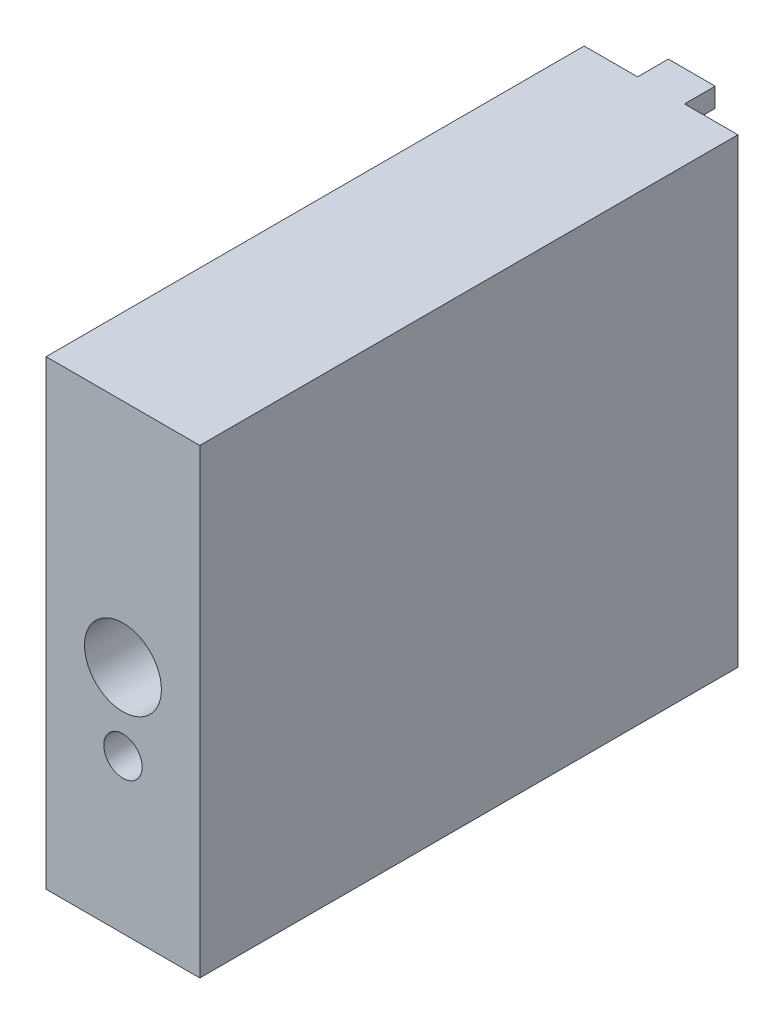
from build123d import *

# Parameters (mm, degrees)
EXTRUDE_1_DEPTH      = 14
CUT_EXTRUDE_1_DEPTH  = 44
SKETCH_3_W           = 6.2
SKETCH_3_H           = 6.2
CUT_EXTRUDE_2_DEPTH  = 4
SKETCH_4_R           = 4
CUT_EXTRUDE_3_DEPTH  = 5
SKETCH_5_R           = 2.6
CUT_EXTRUDE_4_DEPTH  = 5
CUT_EXTRUDE_5_DEPTH  = 50
EXTRUDE_2_DEPTH      = 8
EXTRUDE_3_DEPTH      = 8
SKETCH_10_W          = 20
SKETCH_10_H          = 10
EXTRUDE_4_DEPTH      = 18
SKETCH_12_R          = 1.48
CUT_EXTRUDE_6_DEPTH  = 20
SKETCH_13_W          = 4
SKETCH_13_H          = 40
CUT_EXTRUDE_7_DEPTH  = 22
SKETCH_16_R          = 5
CUT_EXTRUDE_8_DEPTH  = 3
SKETCH_17_R          = 5
CUT_EXTRUDE_9_DEPTH  = 3
SKETCH_18_R          = 2.6
CUT_EXTRUDE_10_DEPTH = 99
SKETCH_19_R          = 5
EXTRUDE_5_DEPTH      = 6
SKETCH_20_W          = 6.2
SKETCH_20_H          = 6.2
CUT_EXTRUDE_11_DEPTH = 4
SKETCH_21_W          = 6.2
SKETCH_21_H          = 6.2
EXTRUDE_6_DEPTH      = 4
SKETCH_22_W          = 0.05
SKETCH_22_H          = 60
CUT_EXTRUDE_12_DEPTH = 4
EXTRUDE_START        = 6
SKETCH_25_W          = 20
SKETCH_25_H          = 10
SKETCH_25_R          = 1.48
EXTRUDE_7_DEPTH      = 6
CUT_EXTRUDE_13_DEPTH = 7
SKETCH_28_W          = 8
SKETCH_28_H          = 10
EXTRUDE_8_DEPTH      = 20
CUT_EXTRUDE_14_DEPTH = 7
SKETCH_30_W          = 6
SKETCH_30_H          = 2.9827115
SKETCH_30_H_2        = 3.265133333
EXTRUDE_9_DEPTH      = 7
SKETCH_31_W          = 6
SKETCH_31_H          = 2
EXTRUDE_10_DEPTH     = 10
SKETCH_32_W          = 6.1
SKETCH_32_H          = 3
CUT_EXTRUDE_15_DEPTH = 10
SKETCH_33_W          = 6.1
SKETCH_33_H          = 3
CUT_EXTRUDE_16_DEPTH = 4
SKETCH_34_W          = 10
SKETCH_34_H          = 5
CUT_EXTRUDE_17_DEPTH = 6
SKETCH_35_W          = 1
SKETCH_35_H          = 5
CUT_EXTRUDE_18_DEPTH = 14
SKETCH_36_W          = 6
SKETCH_36_H          = 5
EXTRUDE_11_DEPTH     = 6
SKETCH_37_W          = 8
SKETCH_37_H          = 1
CUT_EXTRUDE_19_DEPTH = 2
SKETCH_38_R          = 5
EXTRUDE_12_DEPTH     = 6
SKETCH_39_R          = 2.6
CUT_EXTRUDE_20_DEPTH = 10
SKETCH_40_R          = 5
CUT_EXTRUDE_21_DEPTH = 3
EXTRUDE_START_2      = 1
SKETCH_41_W          = 20
SKETCH_41_H          = 40
SKETCH_41_R          = 5
EXTRUDE_13_DEPTH     = 1
SKETCH_42_W          = 20
SKETCH_42_H          = 10
SKETCH_42_R          = 1.48
EXTRUDE_14_DEPTH     = 1
SKETCH_43_W          = 5
SKETCH_43_H          = 5
CUT_EXTRUDE_22_DEPTH = 15
EXTRUDE_15_DEPTH     = 2
SKETCH_45_W          = 6.1
SKETCH_45_H          = 18.1
EXTRUDE_16_DEPTH     = 10
CUT_EXTRUDE_START    = -4
CUT_EXTRUDE_23_DEPTH = 4
SKETCH_47_W          = 15
SKETCH_47_H          = 7.002427308
EXTRUDE_17_DEPTH     = 4
CUT_EXTRUDE_24_DEPTH = 1
SKETCH_49_W          = 2
SKETCH_49_H          = 1
CUT_EXTRUDE_27_DEPTH = 12.5
SKETCH_51_W          = 5
SKETCH_51_H          = 1
EXTRUDE_18_DEPTH     = 1
CUT_EXTRUDE_28_DEPTH = 5
EXTRUDE_19_DEPTH     = 7.5
SKETCH_54_W          = 6.95
SKETCH_54_H          = 2
CUT_EXTRUDE_29_DEPTH = 7.5
SKETCH_55_W          = 6.1
SKETCH_55_H          = 3
CUT_EXTRUDE_30_DEPTH = 4
SKETCH_56_W          = 0.55
SKETCH_56_H          = 0.142857143
EXTRUDE_20_DEPTH     = 4
SKETCH_60_W          = 26.3
SKETCH_60_H          = 60
EXTRUDE_21_DEPTH     = 20
EXTRUDE_22_DEPTH     = 4
SKETCH_62_R          = 2.6
CUT_EXTRUDE_31_DEPTH = 50
SKETCH_63_R          = 5
CUT_EXTRUDE_32_DEPTH = 30.3
CUT_EXTRUDE_33_DEPTH = 4
CUT_EXTRUDE_34_DEPTH = 2
SKETCH_66_W          = 5
SKETCH_66_H          = 2
CUT_EXTRUDE_35_DEPTH = 50
CUT_EXTRUDE_36_DEPTH = 4
SKETCH_68_W          = 5
SKETCH_68_H          = 2
CUT_EXTRUDE_37_DEPTH = 2
SKETCH_69_W          = 13
SKETCH_69_H          = 7
EXTRUDE_23_DEPTH     = 15
SKETCH_70_W          = 13
SKETCH_70_H          = 7
CUT_EXTRUDE_38_DEPTH = 15
SKETCH_72_W          = 20
SKETCH_72_H          = 60
EXTRUDE_24_DEPTH     = 61.3
SKETCH_73_W          = 6.1
SKETCH_73_H          = 12
EXTRUDE_25_DEPTH     = 4
SKETCH_74_R          = 2.6
CUT_EXTRUDE_39_DEPTH = 70
SKETCH_76_W          = 70
SKETCH_76_H          = 60
EXTRUDE_26_DEPTH     = 20
SKETCH_77_R          = 2.6
CUT_EXTRUDE_40_DEPTH = 70
SKETCH_78_R          = 5
CUT_EXTRUDE_41_DEPTH = 67
SKETCH_79_R          = 2.5
CUT_EXTRUDE_42_DEPTH = 30
SKETCH_80_R          = 1.48
CUT_EXTRUDE_43_DEPTH = 10
SKETCH_81_W          = 4.45
SKETCH_81_H          = 15
SKETCH_81_W_2        = 6.1
CUT_EXTRUDE_45_DEPTH = 65
SKETCH_82_W          = 4.45
SKETCH_82_H          = 12.5
SKETCH_82_W_2        = 3.05
CUT_EXTRUDE_46_DEPTH = 65


with BuildPart() as part:
    # 草图1 → 凸台-拉伸1 (new body)
    with BuildSketch(Plane.XY):
        Polygon((-15, 22), (-15, -22), (15, -22), (15, 22), (0, 22), align=None)
    extrude(amount=EXTRUDE_1_DEPTH)

    # 草图2 → 切除-拉伸1 (cut)
    with BuildSketch(Plane(origin=(0, 22, 0), x_dir=(1, 0, 0), z_dir=(0, 1, 0))):
        Polygon((-15, 0), (-15, -14), (-10, -4), (-3.1, -4), (-3.1, 0), align=None)
        Polygon((3.1, -4), (10, -4), (15, -14), (15, 0), (3.1, 0), align=None)
    extrude(amount=-CUT_EXTRUDE_1_DEPTH, mode=Mode.SUBTRACT)

    # 草图3 → 切除-拉伸2 (cut)
    with BuildSketch(Plane(origin=(0, 0, 0), x_dir=(-1, 0, 0), z_dir=(0, 0, -1))):
        Rectangle(SKETCH_3_W, SKETCH_3_H)
    extrude(amount=-CUT_EXTRUDE_2_DEPTH, mode=Mode.SUBTRACT)

    # 草图4 → 切除-拉伸3 (cut)
    with BuildSketch(Plane.XY.offset(14)):
        Circle(SKETCH_4_R)
    extrude(amount=-CUT_EXTRUDE_3_DEPTH, mode=Mode.SUBTRACT)

    # 草图5 → 切除-拉伸4 (cut)
    with BuildSketch(Plane.XY.offset(9)):
        Circle(SKETCH_5_R)
    extrude(amount=-CUT_EXTRUDE_4_DEPTH, mode=Mode.SUBTRACT)

    # 草图6 → 切除-拉伸5 (cut)
    with BuildSketch(Plane.XZ.offset(22)):
        Polygon((-10, 4), (-15, 14), (-10, 14), align=None)
        Polygon((10, 4), (10, 14), (15, 14), align=None)
    extrude(amount=-CUT_EXTRUDE_5_DEPTH, mode=Mode.SUBTRACT)

    # 草图8 → 凸台-拉伸2 (add)
    with BuildSketch(Plane(origin=(0, -22, 0), x_dir=(-1, 0, 0), z_dir=(0, -1, 0))):
        Polygon((10, -14), (-10, -14), (-10, -4), (-3.1, -4), (-3.1, 0), (3.1, 0), (3.1, -4), (10, -4), align=None)
    extrude(amount=EXTRUDE_2_DEPTH)

    # 草图9 → 凸台-拉伸3 (add)
    with BuildSketch(Plane(origin=(0, 22, 0), x_dir=(1, 0, 0), z_dir=(0, 1, 0))):
        Polygon((-3.1, -4), (-3.1, 0), (3.1, 0), (3.1, -4), (10, -4), (10, -14), (-10, -14), (-10, -4), align=None)
    extrude(amount=EXTRUDE_3_DEPTH)

    # 草图10 → 凸台-拉伸4 (add)
    with BuildSketch(Plane.XY.offset(14)):
        with Locations((0, 25)):
            Rectangle(SKETCH_10_W, SKETCH_10_H)
        with Locations((0, -25)):
            Rectangle(SKETCH_10_W, SKETCH_10_H)
    extrude(amount=EXTRUDE_4_DEPTH)

    # 草图12 → 切除-拉伸6 (cut)
    with BuildSketch(Plane.XY.offset(32)):
        with Locations((-4.9, -24.6)):
            Circle(SKETCH_12_R)
        with Locations((4.9, -24.6)):
            Circle(SKETCH_12_R)
        with Locations((-4.9, 24.6)):
            Circle(SKETCH_12_R)
        with Locations((4.9, 24.6)):
            Circle(SKETCH_12_R)
    extrude(amount=-CUT_EXTRUDE_6_DEPTH, mode=Mode.SUBTRACT)

    # 草图13 → 切除-拉伸7 (cut)
    with BuildSketch(Plane(origin=(10, 0, 0), x_dir=(0, 0, -1), z_dir=(1, 0, 0))):
        with Locations((-12, 0)):
            Rectangle(SKETCH_13_W, SKETCH_13_H)
    extrude(amount=-CUT_EXTRUDE_7_DEPTH, mode=Mode.SUBTRACT)

    # 草图16 → 切除-拉伸8 (cut)
    with BuildSketch(Plane.XY.offset(10)):
        Circle(SKETCH_16_R)
    extrude(amount=-CUT_EXTRUDE_8_DEPTH, mode=Mode.SUBTRACT)

    # 草图17 → 切除-拉伸9 (cut)
    with BuildSketch(Plane.XY.offset(10)):
        with Locations((0, 15)):
            Circle(SKETCH_17_R)
        with Locations((0, -15)):
            Circle(SKETCH_17_R)
    extrude(amount=-CUT_EXTRUDE_9_DEPTH, mode=Mode.SUBTRACT)

    # 草图18 → 切除-拉伸10 (cut)
    with BuildSketch(Plane.XY.offset(7)):
        with Locations((0, 15)):
            Circle(SKETCH_18_R)
        with Locations((0, -15)):
            Circle(SKETCH_18_R)
    extrude(amount=-CUT_EXTRUDE_10_DEPTH, mode=Mode.SUBTRACT)

    # 草图19 → 凸台-拉伸5 (add)
    with BuildSketch(Plane.XY.offset(10)):
        Circle(SKETCH_19_R)
    extrude(amount=-EXTRUDE_5_DEPTH)

    # 草图20 → 切除-拉伸11 (cut)
    with BuildSketch(Plane(origin=(0, 0, 0), x_dir=(-1, 0, 0), z_dir=(0, 0, -1))):
        Polygon((0, -11.9), (0, -15), (0, -18.1), (3.1, -18.1), (3.1, -11.9), align=None)
        Polygon((0, -18.1), (0, -15), (0, -11.9), (-3.1, -11.9), (-3.1, -18.1), align=None)
        with Locations((0, 15)):
            Rectangle(SKETCH_20_W, SKETCH_20_H)
    extrude(amount=-CUT_EXTRUDE_11_DEPTH, mode=Mode.SUBTRACT)

    # 草图21 → 凸台-拉伸6 (add)
    with BuildSketch(Plane(origin=(0, 0, 0), x_dir=(-1, 0, 0), z_dir=(0, 0, -1))):
        Rectangle(SKETCH_21_W, SKETCH_21_H)
    extrude(amount=-EXTRUDE_6_DEPTH)

    # 草图22 → 切除-拉伸12 (cut)
    with BuildSketch(Plane(origin=(0, 0, 0), x_dir=(-1, 0, 0), z_dir=(0, 0, -1))):
        with Locations((-3.075, 0)):
            Rectangle(SKETCH_22_W, SKETCH_22_H)
        with Locations((3.075, 0)):
            Rectangle(SKETCH_22_W, SKETCH_22_H)
    extrude(amount=-CUT_EXTRUDE_12_DEPTH, mode=Mode.SUBTRACT)

    # 草图25 → 凸台-拉伸7 (add)
    # profile 1 of 2: a face of its own
    with BuildSketch(Plane.XY.offset(32).offset(EXTRUDE_START)):
        with Locations((0, 25)):
            Rectangle(SKETCH_25_W, SKETCH_25_H)
        with Locations((-4.9, 24.6)):
            Circle(SKETCH_25_R, mode=Mode.SUBTRACT)
        with Locations((4.9, 24.6)):
            Circle(SKETCH_25_R, mode=Mode.SUBTRACT)
    # profile 2 of 2: a face of its own
    with BuildSketch(Plane.XY.offset(32).offset(EXTRUDE_START)):
        with Locations((0, -25)):
            Rectangle(SKETCH_25_W, SKETCH_25_H)
        with Locations((-4.9, -24.6)):
            Circle(SKETCH_25_R, mode=Mode.SUBTRACT)
        with Locations((4.9, -24.6)):
            Circle(SKETCH_25_R, mode=Mode.SUBTRACT)
    extrude(amount=-EXTRUDE_7_DEPTH)

    # 草图27 → 切除-拉伸13 (cut)
    with BuildSketch(Plane(origin=(0, -20, 0), x_dir=(1, 0, 0), z_dir=(0, 1, 0))):
        Polygon((4, -15), (4, -10), (0, -10), (-4, -10), (-4, -15), align=None)
    extrude(amount=-CUT_EXTRUDE_13_DEPTH, mode=Mode.SUBTRACT)

    # 草图28 → 凸台-拉伸8 (add)
    with BuildSketch(Plane.ZY.offset(10)):
        with Locations((14, -25)):
            Rectangle(SKETCH_28_W, SKETCH_28_H)
        with Locations((14, 25)):
            Rectangle(SKETCH_28_W, SKETCH_28_H)
    extrude(amount=-EXTRUDE_8_DEPTH)

    # 草图29 → 切除-拉伸14 (cut)
    with BuildSketch(Plane(origin=(0, -20, 0), x_dir=(1, 0, 0), z_dir=(0, 1, 0))):
        Polygon((4, -20), (4, -10), (0, -10), (-4, -10), (-4, -20), align=None)
    extrude(amount=-CUT_EXTRUDE_14_DEPTH, mode=Mode.SUBTRACT)

    # 草图30 → 凸台-拉伸9 (add)
    with BuildSketch(Plane(origin=(0, -20, 0), x_dir=(1, 0, 0), z_dir=(0, 1, 0))):
        with Locations((-7, -18.50864425)):
            Rectangle(SKETCH_30_W, SKETCH_30_H)
        with Locations((7, -18.367433334)):
            Rectangle(SKETCH_30_W, SKETCH_30_H_2)
    extrude(amount=-EXTRUDE_9_DEPTH)

    # 草图31 → 凸台-拉伸10 (add)
    with BuildSketch(Plane(origin=(0, -20, 0), x_dir=(1, 0, 0), z_dir=(0, 1, 0))):
        with Locations((7, -21)):
            Rectangle(SKETCH_31_W, SKETCH_31_H)
        Polygon((4, -22), (4, -20), (-4, -20), (-10, -20), (-10, -22), align=None)
    extrude(amount=-EXTRUDE_10_DEPTH)

    # 草图32 → 切除-拉伸15 (cut)
    with BuildSketch(Plane(origin=(0, 0, 0), x_dir=(-1, 0, 0), z_dir=(0, 0, -1))):
        with Locations((0, -25.5)):
            Rectangle(SKETCH_32_W, SKETCH_32_H)
    extrude(amount=-CUT_EXTRUDE_15_DEPTH, mode=Mode.SUBTRACT)

    # 草图33 → 切除-拉伸16 (cut)
    with BuildSketch(Plane(origin=(0, 0, 0), x_dir=(-1, 0, 0), z_dir=(0, 0, -1))):
        with Locations((0, -28.5)):
            Rectangle(SKETCH_33_W, SKETCH_33_H)
    extrude(amount=-CUT_EXTRUDE_16_DEPTH, mode=Mode.SUBTRACT)

    # 草图34 → 切除-拉伸17 (cut)
    with BuildSketch(Plane.ZY.offset(10)):
        with Locations((15, -22.5)):
            Rectangle(SKETCH_34_W, SKETCH_34_H)
    extrude(amount=-CUT_EXTRUDE_17_DEPTH, mode=Mode.SUBTRACT)

    # 草图35 → 切除-拉伸18 (cut)
    with BuildSketch(Plane.ZY.offset(10)):
        with Locations((20.5, -22.5)):
            Rectangle(SKETCH_35_W, SKETCH_35_H)
    extrude(amount=-CUT_EXTRUDE_18_DEPTH, mode=Mode.SUBTRACT)

    # 草图36 → 凸台-拉伸11 (add)
    with BuildSketch(Plane.ZY.offset(10)):
        with Locations((13, -22.5)):
            Rectangle(SKETCH_36_W, SKETCH_36_H)
    extrude(amount=-EXTRUDE_11_DEPTH)

    # 草图37 → 切除-拉伸19 (cut)
    with BuildSketch(Plane(origin=(0, -25, 0), x_dir=(1, 0, 0), z_dir=(0, 1, 0))):
        with Locations((0, -20.5)):
            Rectangle(SKETCH_37_W, SKETCH_37_H)
    extrude(amount=-CUT_EXTRUDE_19_DEPTH, mode=Mode.SUBTRACT)

    # 草图38 → 凸台-拉伸12 (add)
    with BuildSketch(Plane.XY.offset(10)):
        with Locations((0, 15)):
            Circle(SKETCH_38_R)
        with Locations((0, -15)):
            Circle(SKETCH_38_R)
    extrude(amount=-EXTRUDE_12_DEPTH)

    # 草图39 → 切除-拉伸20 (cut)
    with BuildSketch(Plane.XY.offset(10)):
        Circle(SKETCH_39_R)
    extrude(amount=-CUT_EXTRUDE_20_DEPTH, mode=Mode.SUBTRACT)

    # 草图40 → 切除-拉伸21 (cut)
    with BuildSketch(Plane.XY.offset(10)):
        Circle(SKETCH_40_R)
    extrude(amount=-CUT_EXTRUDE_21_DEPTH, mode=Mode.SUBTRACT)

    # 草图41 → 凸台-拉伸13 (add)
    with BuildSketch(Plane.XY.offset(10).offset(EXTRUDE_START_2)):
        Rectangle(SKETCH_41_W, SKETCH_41_H)
        Circle(SKETCH_41_R, mode=Mode.SUBTRACT)
    extrude(amount=-EXTRUDE_13_DEPTH)

    # 草图42 → 凸台-拉伸14 (add)
    # profile 1 of 2: a face of its own
    with BuildSketch(Plane.XY.offset(38).offset(EXTRUDE_START_2)):
        with Locations((0, 25)):
            Rectangle(SKETCH_42_W, SKETCH_42_H)
        with Locations((-4.9, 24.6)):
            Circle(SKETCH_42_R, mode=Mode.SUBTRACT)
        with Locations((4.9, 24.6)):
            Circle(SKETCH_42_R, mode=Mode.SUBTRACT)
    # profile 2 of 2: a face of its own
    with BuildSketch(Plane.XY.offset(38).offset(EXTRUDE_START_2)):
        with Locations((0, -25)):
            Rectangle(SKETCH_42_W, SKETCH_42_H)
        with Locations((-4.9, -24.6)):
            Circle(SKETCH_42_R, mode=Mode.SUBTRACT)
        with Locations((4.9, -24.6)):
            Circle(SKETCH_42_R, mode=Mode.SUBTRACT)
    extrude(amount=-EXTRUDE_14_DEPTH)

    # 草图43 → 切除-拉伸22 (cut)
    with BuildSketch(Plane.ZY.offset(10)):
        Polygon((24, -27), (24, -20), (21, -20), (21, -25), (16, -25), (16, -20), (11, -20), (10.997708979, -20), (10.997708979, -27), align=None)
        with Locations((18.5, -22.5)):
            Rectangle(SKETCH_43_W, SKETCH_43_H)
    extrude(amount=-CUT_EXTRUDE_22_DEPTH, mode=Mode.SUBTRACT)

    # 草图44 → 凸台-拉伸15 (add)
    with BuildSketch(Plane(origin=(0, 0, 24), x_dir=(-1, 0, 0), z_dir=(0, 0, -1))):
        with BuildLine():
            Line((-5, -26.076617757), (-5, -23.123382243))
            ThreePointArc((-5, -23.123382243), (-6.38, -24.6), (-5, -26.076617757))
        make_face()
    extrude(amount=EXTRUDE_15_DEPTH)

    # 草图45 → 凸台-拉伸16 (add)
    with BuildSketch(Plane(origin=(0, 0, 0), x_dir=(-1, 0, 0), z_dir=(0, 0, -1))):
        with Locations((0, -20.95)):
            Rectangle(SKETCH_45_W, SKETCH_45_H)
        with Locations((0, 20.95)):
            Rectangle(SKETCH_45_W, SKETCH_45_H)
    extrude(amount=-EXTRUDE_16_DEPTH)

    # 草图46 → 切除-拉伸23 (cut)
    with BuildSketch(Plane(origin=(0, 0, 0), x_dir=(-1, 0, 0), z_dir=(0, 0, -1)).offset(CUT_EXTRUDE_START)):
        with BuildLine():
            Line((0, 2.6), (0, 0))
            Line((0, 0), (0, -2.6))
            ThreePointArc((0, -2.6), (1.838477631, -1.838477631), (2.6, 0))
            ThreePointArc((2.6, 0), (1.838477631, 1.838477631), (0, 2.6))
        make_face()
        with BuildLine():
            Line((0, -2.6), (0, 0))
            Line((0, 0), (0, 2.6))
            ThreePointArc((0, 2.6), (-2.6, 0), (0, -2.6))
        make_face()
        with BuildLine():
            ThreePointArc((0, -2.6), (-2.6, 0), (0, 2.6))
            Line((0, 2.6), (0, 3.05))
            Line((0, 3.05), (-3.05, 3.05))
            Line((-3.05, 3.05), (-3.05, -3.05))
            Line((-3.05, -3.05), (0, -3.05))
            Line((0, -3.05), (0, -2.6))
        make_face()
        with BuildLine():
            Line((0, 3.05), (0, 2.6))
            ThreePointArc((0, 2.6), (1.838477631, 1.838477631), (2.6, 0))
            ThreePointArc((2.6, 0), (1.838477631, -1.838477631), (0, -2.6))
            Line((0, -2.6), (0, -3.05))
            Line((0, -3.05), (3.05, -3.05))
            Line((3.05, -3.05), (3.05, 3.05))
            Line((3.05, 3.05), (0, 3.05))
        make_face()
    extrude(amount=CUT_EXTRUDE_23_DEPTH, mode=Mode.SUBTRACT)

    # 草图47 → 凸台-拉伸17 (add)
    with BuildSketch(Plane.XY.offset(11)):
        with Locations((-2.5, -23.501213654)):
            Rectangle(SKETCH_47_W, SKETCH_47_H)
    extrude(amount=-EXTRUDE_17_DEPTH)

    # 草图48 → 切除-拉伸24 (cut)
    with BuildSketch(Plane.XY.offset(11)):
        with BuildLine():
            Line((-2.5, 20), (-2.5, 4.330127019))
            ThreePointArc((-2.5, 4.330127019), (0, 5), (2.5, 4.330127019))
            Line((2.5, 4.330127019), (2.5, 20))
            Line((2.5, 20), (-2.5, 20))
        make_face()
        with BuildLine():
            Line((-2.5, -27), (0, -27))
            Line((0, -27), (2.5, -27))
            Line((2.5, -27), (2.5, -4.330127019))
            ThreePointArc((2.5, -4.330127019), (0, -5), (-2.5, -4.330127019))
            Line((-2.5, -4.330127019), (-2.5, -27))
        make_face()
    extrude(amount=-CUT_EXTRUDE_24_DEPTH, mode=Mode.SUBTRACT)

    # 草图49 → 切除-拉伸27 (cut)
    with BuildSketch(Plane.ZY.offset(10)):
        with Locations((10, 19.5)):
            Rectangle(SKETCH_49_W, SKETCH_49_H)
        Polygon((9, 20), (11, 20), (4, 30), (4, 27.142857143), align=None)
        Polygon((4, 27.142857143), (4, 30), (4, 31.546618197), (2, 31.546618197), (2, 30), align=None)
    extrude(amount=-CUT_EXTRUDE_27_DEPTH, mode=Mode.SUBTRACT)

    # 草图51 → 凸台-拉伸18 (add)
    with BuildSketch(Plane(origin=(0, 19, 0), x_dir=(1, 0, 0), z_dir=(0, 1, 0))):
        with Locations((0, -9.5)):
            Rectangle(SKETCH_51_W, SKETCH_51_H)
    extrude(amount=EXTRUDE_18_DEPTH)

    # 草图52 → 切除-拉伸28 (cut)
    with BuildSketch(Plane.ZY.offset(2.5)):
        Polygon((9, 20), (10, 19), (10, 20), align=None)
    extrude(amount=-CUT_EXTRUDE_28_DEPTH, mode=Mode.SUBTRACT)

    # 草图53 → 凸台-拉伸19 (add)
    with BuildSketch(Plane.ZY.offset(10)):
        Polygon((11, 20), (4, 30), (2, 30), (9, 20), (9, 19), (11, 19), align=None)
    extrude(amount=-EXTRUDE_19_DEPTH)

    # 草图54 → 切除-拉伸29 (cut)
    with BuildSketch(Plane(origin=(0, 30, 0), x_dir=(1, 0, 0), z_dir=(0, 1, 0))):
        with Locations((-6.525, -3)):
            Rectangle(SKETCH_54_W, SKETCH_54_H)
    extrude(amount=-CUT_EXTRUDE_29_DEPTH, mode=Mode.SUBTRACT)

    # 草图55 → 切除-拉伸30 (cut)
    with BuildSketch(Plane(origin=(0, 0, 0), x_dir=(-1, 0, 0), z_dir=(0, 0, -1))):
        with Locations((0, 28.5)):
            Rectangle(SKETCH_55_W, SKETCH_55_H)
    extrude(amount=-CUT_EXTRUDE_30_DEPTH, mode=Mode.SUBTRACT)

    # 草图56 → 凸台-拉伸20 (add)
    with BuildSketch(Plane(origin=(0, 0, 4), x_dir=(-1, 0, 0), z_dir=(0, 0, -1))):
        with Locations((-2.775, 27.071428572)):
            Rectangle(SKETCH_56_W, SKETCH_56_H)
        Polygon((2.5, 27.142857143), (-2.5, 27.142857143), (-2.5, 27), (3.05, 27), (3.05, 27.142857143), align=None)
    extrude(amount=EXTRUDE_20_DEPTH)

    # 草图60 → 凸台-拉伸21 (add)
    with BuildSketch(Plane.ZY.offset(10)):
        with Locations((-9.15, 0)):
            Rectangle(SKETCH_60_W, SKETCH_60_H)
        Polygon((11, -27), (11, 20), (11, 30), (4, 30), (4, -30), (11, -30), align=None)
    extrude(amount=-EXTRUDE_21_DEPTH)

    # 草图61 → 凸台-拉伸22 (add)
    with BuildSketch(Plane(origin=(0, 0, -22.3), x_dir=(-1, 0, 0), z_dir=(0, 0, -1))):
        Polygon((0, -30), (0, 0), (0, 30), (-3.05, 30), (-3.05, -30), align=None)
        Polygon((0, 30), (0, 0), (0, -30), (3.05, -30), (3.05, 30), align=None)
    extrude(amount=EXTRUDE_22_DEPTH)

    # 草图62 → 切除-拉伸31 (cut)
    with BuildSketch(Plane.XY.offset(11)):
        Circle(SKETCH_62_R)
    extrude(amount=-CUT_EXTRUDE_31_DEPTH, mode=Mode.SUBTRACT)

    # 草图63 → 切除-拉伸32 (cut)
    with BuildSketch(Plane.XY.offset(11)):
        Circle(SKETCH_63_R)
    extrude(amount=-CUT_EXTRUDE_32_DEPTH, mode=Mode.SUBTRACT)

    # 草图64 → 切除-拉伸33 (cut)
    with BuildSketch(Plane(origin=(0, 0, -26.3), x_dir=(-1, 0, 0), z_dir=(0, 0, -1)).offset(CUT_EXTRUDE_START)):
        with BuildLine():
            Line((0, 3.05), (0, 2.6))
            ThreePointArc((0, 2.6), (1.838477631, 1.838477631), (2.6, 0))
            ThreePointArc((2.6, 0), (1.838477631, -1.838477631), (0, -2.6))
            Line((0, -2.6), (0, -3.05))
            Line((0, -3.05), (3.05, -3.05))
            Line((3.05, -3.05), (3.05, 3.05))
            Line((3.05, 3.05), (0, 3.05))
        make_face()
        with BuildLine():
            ThreePointArc((0, -2.6), (-2.6, 0), (0, 2.6))
            Line((0, 2.6), (0, 3.05))
            Line((0, 3.05), (-3.05, 3.05))
            Line((-3.05, 3.05), (-3.05, -3.05))
            Line((-3.05, -3.05), (0, -3.05))
            Line((0, -3.05), (0, -2.6))
        make_face()
    extrude(amount=CUT_EXTRUDE_33_DEPTH, mode=Mode.SUBTRACT)

    # 草图65 → 切除-拉伸34 (cut)
    with BuildSketch(Plane.XY.offset(11)):
        with BuildLine():
            Line((0, 20), (0, 5))
            ThreePointArc((0, 5), (1.294095226, 4.829629131), (2.5, 4.330127019))
            Line((2.5, 4.330127019), (2.5, 20))
            Line((2.5, 20), (0, 20))
        make_face()
        with BuildLine():
            ThreePointArc((-2.5, 4.330127019), (-1.294095226, 4.829629131), (0, 5))
            Line((0, 5), (0, 20))
            Line((0, 20), (-2.5, 20))
            Line((-2.5, 20), (-2.5, 4.330127019))
        make_face()
        with BuildLine():
            ThreePointArc((2.5, -4.330127019), (1.294095226, -4.829629131), (0, -5))
            Line((0, -5), (0, -27))
            Line((0, -27), (2.5, -27))
            Line((2.5, -27), (2.5, -4.330127019))
        make_face()
        with BuildLine():
            Line((0, -27), (0, -5))
            ThreePointArc((0, -5), (-1.294095226, -4.829629131), (-2.5, -4.330127019))
            Line((-2.5, -4.330127019), (-2.5, -27))
            Line((-2.5, -27), (0, -27))
        make_face()
    extrude(amount=-CUT_EXTRUDE_34_DEPTH, mode=Mode.SUBTRACT)

    # 草图66 → 切除-拉伸35 (cut)
    with BuildSketch(Plane.XY.offset(9)):
        with Locations((0, 19)):
            Rectangle(SKETCH_66_W, SKETCH_66_H)
    extrude(amount=-CUT_EXTRUDE_35_DEPTH, mode=Mode.SUBTRACT)

    # 草图67 → 切除-拉伸36 (cut)
    with BuildSketch(Plane(origin=(0, 0, -26.3), x_dir=(-1, 0, 0), z_dir=(0, 0, -1))):
        Polygon((2.5, 20), (2.5, 18), (3.05, 18), (3.05, 30), (-3.05, 30), (-3.05, 18), (-2.5, 18), (-2.5, 20), align=None)
    extrude(amount=-CUT_EXTRUDE_36_DEPTH, mode=Mode.SUBTRACT)

    # 草图68 → 切除-拉伸37 (cut)
    with BuildSketch(Plane.XY.offset(9)):
        with Locations((0, 17)):
            Rectangle(SKETCH_68_W, SKETCH_68_H)
    extrude(amount=-CUT_EXTRUDE_37_DEPTH, mode=Mode.SUBTRACT)

    # 草图69 → 凸台-拉伸23 (add)
    with BuildSketch(Plane.ZY.offset(-5)):
        with Locations((17.5, -23.5)):
            Rectangle(SKETCH_69_W, SKETCH_69_H)
    extrude(amount=EXTRUDE_23_DEPTH)

    # 草图70 → 切除-拉伸38 (cut)
    with BuildSketch(Plane(origin=(10, 0, 0), x_dir=(0, 0, -1), z_dir=(1, 0, 0))):
        with Locations((-17.5, -23.5)):
            Rectangle(SKETCH_70_W, SKETCH_70_H)
    extrude(amount=-CUT_EXTRUDE_38_DEPTH, mode=Mode.SUBTRACT)

    # 草图72 → 凸台-拉伸24 (add)
    with BuildSketch(Plane.XY.offset(39)):
        Rectangle(SKETCH_72_W, SKETCH_72_H)
    extrude(amount=-EXTRUDE_24_DEPTH)

    # 草图73 → 凸台-拉伸25 (add)
    with BuildSketch(Plane(origin=(0, 0, -26.3), x_dir=(-1, 0, 0), z_dir=(0, 0, -1))):
        with Locations((0, 24)):
            Rectangle(SKETCH_73_W, SKETCH_73_H)
    extrude(amount=-EXTRUDE_25_DEPTH)

    # 草图74 → 切除-拉伸39 (cut)
    with BuildSketch(Plane(origin=(0, 0, -22.3), x_dir=(-1, 0, 0), z_dir=(0, 0, -1))):
        with Locations(Location((0, 0, 0), (0, 0, 90))):
            Circle(SKETCH_74_R)
    extrude(amount=-CUT_EXTRUDE_39_DEPTH, mode=Mode.SUBTRACT)

    # 草图76 → 凸台-拉伸26 (add)
    with BuildSketch(Plane.ZY.offset(10)):
        with Locations((12.7, 0)):
            Rectangle(SKETCH_76_W, SKETCH_76_H)
    extrude(amount=-EXTRUDE_26_DEPTH)

    # 草图77 → 切除-拉伸40 (cut)
    with BuildSketch(Plane(origin=(0, 0, -22.3), x_dir=(-1, 0, 0), z_dir=(0, 0, -1))):
        with Locations(Location((0, 0, 0), (0, 0, 90))):
            Circle(SKETCH_77_R)
    extrude(amount=-CUT_EXTRUDE_40_DEPTH, mode=Mode.SUBTRACT)

    # 草图78 → 切除-拉伸41 (cut)
    with BuildSketch(Plane.XY.offset(47.7)):
        Circle(SKETCH_78_R)
    extrude(amount=-CUT_EXTRUDE_41_DEPTH, mode=Mode.SUBTRACT)

    # 草图79 → 切除-拉伸42 (cut)
    with BuildSketch(Plane.XY.offset(47.7)):
        with Locations((0, -10)):
            Circle(SKETCH_79_R)
    extrude(amount=-CUT_EXTRUDE_42_DEPTH, mode=Mode.SUBTRACT)

    # 草图80 → 切除-拉伸43 (cut)
    with BuildSketch(Plane.XY.offset(17.7)):
        with Locations((0, -10)):
            Circle(SKETCH_80_R)
    extrude(amount=-CUT_EXTRUDE_43_DEPTH, mode=Mode.SUBTRACT)

    # 草图81 → 切除-拉伸45 (cut)
    with BuildSketch(Plane(origin=(0, 0, -26.3), x_dir=(-1, 0, 0), z_dir=(0, 0, -1))):
        with Locations((-5.275, 20)):
            Rectangle(SKETCH_81_W, SKETCH_81_H)
        with Locations((0, 20)):
            Rectangle(SKETCH_81_W_2, SKETCH_81_H)
        with Locations((5.275, 20)):
            Rectangle(SKETCH_81_W, SKETCH_81_H)
    extrude(amount=-CUT_EXTRUDE_45_DEPTH, mode=Mode.SUBTRACT)

    # 草图82 → 切除-拉伸46 (cut)
    with BuildSketch(Plane(origin=(0, 0, -26.3), x_dir=(-1, 0, 0), z_dir=(0, 0, -1))):
        with Locations((5.275, -21.25)):
            Rectangle(SKETCH_82_W, SKETCH_82_H)
        with Locations((-5.275, -21.25)):
            Rectangle(SKETCH_82_W, SKETCH_82_H)
        with Locations((-1.525, -21.25)):
            Rectangle(SKETCH_82_W_2, SKETCH_82_H)
        with Locations((1.525, -21.25)):
            Rectangle(SKETCH_82_W_2, SKETCH_82_H)
    extrude(amount=-CUT_EXTRUDE_46_DEPTH, mode=Mode.SUBTRACT)


solid = part.part
